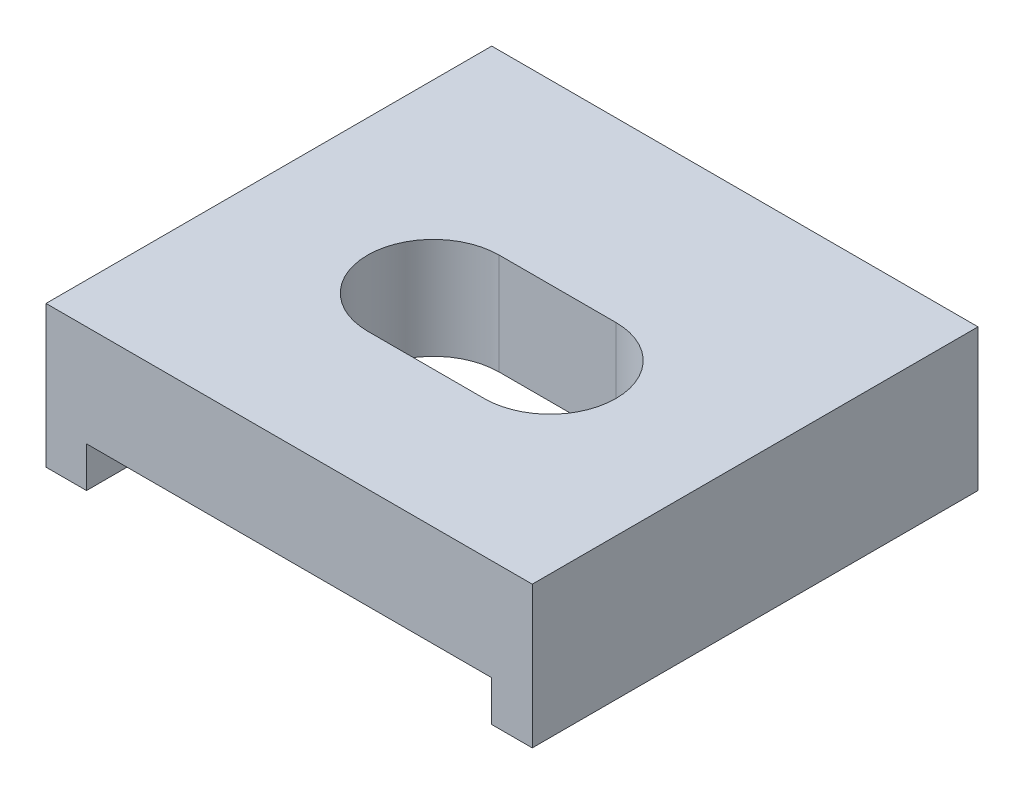
from build123d import *

# Parameters (mm, degrees)
SKETCH1_W           = 10
SKETCH1_H           = 10
BOSS_EXTRUDE1_DEPTH = 2.5
BOSS_EXTRUDE2_DEPTH = 3.5


with BuildPart() as part:
    # Sketch1 → Boss-Extrude1 (new body)
    with BuildSketch(Plane(origin=(0, 0, 0), x_dir=(1, 0, 0), z_dir=(0, 1, 0))):
        Rectangle(SKETCH1_W, SKETCH1_H)
        with BuildLine():
            ThreePointArc((-1.44, 1.625), (-3.065, 0), (-1.44, -1.625))
            Line((-1.44, -1.625), (1.44, -1.625))
            ThreePointArc((1.44, -1.625), (3.065, 0), (1.44, 1.625))
            Line((1.44, 1.625), (-1.44, 1.625))
        make_face(mode=Mode.SUBTRACT)
    extrude(amount=BOSS_EXTRUDE1_DEPTH)

    # Sketch2 → Boss-Extrude2 (add)
    with BuildSketch(Plane(origin=(0, 2.5, 0), x_dir=(1, 0, 0), z_dir=(0, 1, 0))):
        Polygon((-5, -5), (-5, 5), (5, 5), (5, -5), (6, -5), (6, 6), (-6, 6), (-6, -5), align=None)
    extrude(amount=-BOSS_EXTRUDE2_DEPTH)


solid = part.part
